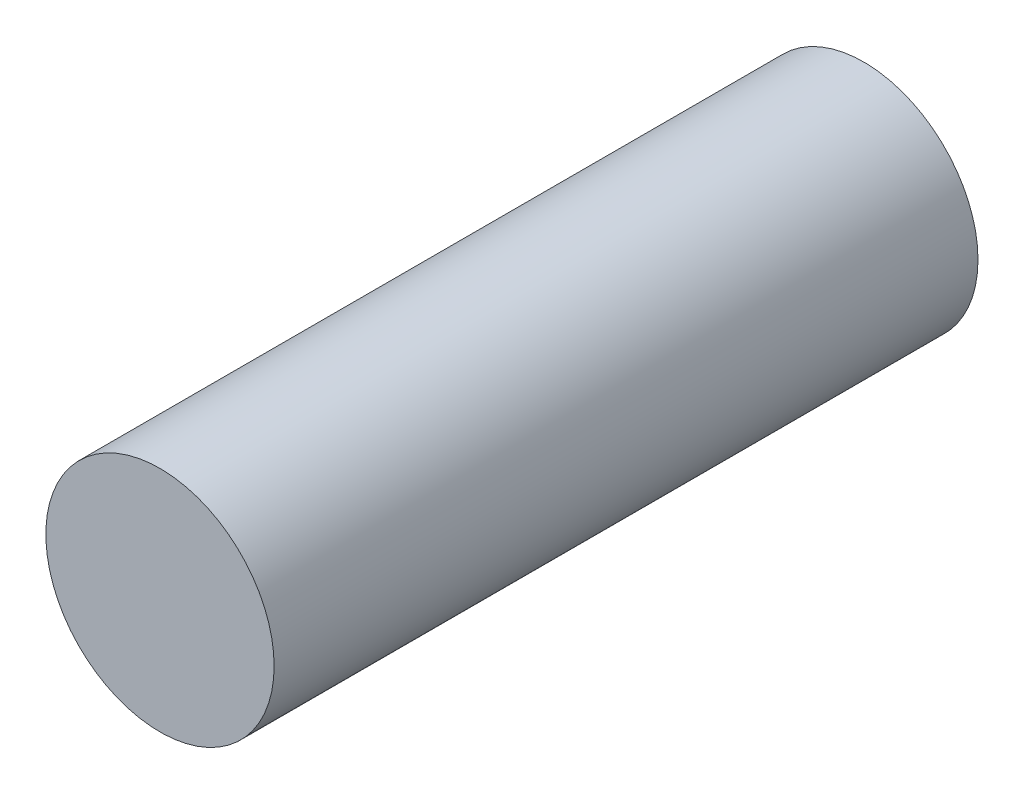
from build123d import *

# Parameters (mm, degrees)
SKETCH1_R           = 12
BOSS_EXTRUDE1_DEPTH = 74


with BuildPart() as part:
    # Sketch1 → Boss-Extrude1 (new body)
    with BuildSketch(Plane.XY):
        Circle(SKETCH1_R)
    extrude(amount=-BOSS_EXTRUDE1_DEPTH)


solid = part.part
